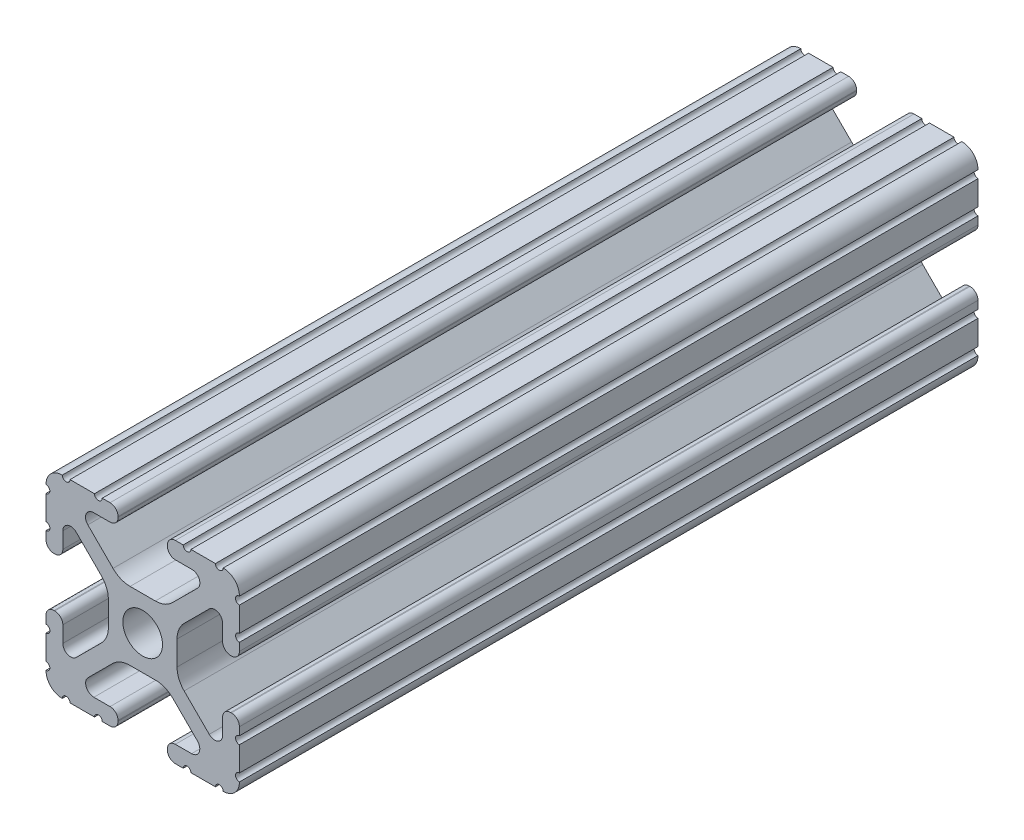
from build123d import *

# Parameters (mm, degrees)
SKETCH1_R      = 2.6035
EXTRUDE1_DEPTH = 97


with BuildPart() as part:
    # Sketch1 → Extrude1 (new body)
    with BuildSketch(Plane.XY):
        with BuildLine():
            Line((-7.207036008, 8.724370562), (-3.898272566, 5.423169045))
            ThreePointArc((-3.898272566, 5.423169045), (-2.869120213, 4.736787962), (-1.655778399, 4.4958))
            Line((-1.655778399, 4.4958), (1.655778399, 4.4958))
            ThreePointArc((1.655778399, 4.4958), (2.869120213, 4.736787962), (3.898272566, 5.423169045))
            Line((3.898272566, 5.423169045), (7.207036008, 8.724370562))
            ThreePointArc((7.207036008, 8.724370562), (7.432222385, 9.85140422), (6.476788598, 10.4902))
            Line((6.476788598, 10.4902), (4.287512407, 10.4902))
            ThreePointArc((4.287512407, 10.4902), (3.54574862, 10.79744862), (3.2385, 11.539212407))
            Line((3.2385, 11.539212407), (3.2385, 11.650987593))
            ThreePointArc((3.2385, 11.650987593), (3.54574862, 12.39275138), (4.287512407, 12.7))
            Line((4.287512407, 12.7), (5.317126718, 12.7))
            ThreePointArc((5.317126718, 12.7), (5.825126718, 12.192), (6.333126718, 12.7))
            Line((6.333126718, 12.7), (9.550443118, 12.7))
            ThreePointArc((9.550443118, 12.7), (10.058366869, 12.192000006), (10.566443095, 12.699847501))
            ThreePointArc((10.566443095, 12.699847501), (12.082537762, 12.08250727), (12.699846982, 10.566399977))
            ThreePointArc((12.699846982, 10.566399977), (12.192000006, 10.058323491), (12.7, 9.5504))
            Line((12.7, 9.5504), (12.7, 6.3330836))
            ThreePointArc((12.7, 6.3330836), (12.192, 5.8250836), (12.7, 5.3170836))
            Line((12.7, 5.3170836), (12.7, 4.287469289))
            ThreePointArc((12.7, 4.287469289), (12.39275138, 3.545705502), (11.650987593, 3.238456882))
            Line((11.650987593, 3.238456882), (11.539212407, 3.238456882))
            ThreePointArc((11.539212407, 3.238456882), (10.79744862, 3.545705502), (10.4902, 4.287469289))
            Line((10.4902, 4.287469289), (10.4902, 6.402089023))
            ThreePointArc((10.4902, 6.402089023), (9.856505071, 7.351067942), (8.737131347, 7.129408934))
            Line((8.737131347, 7.129408934), (5.441005833, 3.840816462))
            ThreePointArc((5.441005833, 3.840816462), (4.750877967, 2.809883091), (4.5085, 1.593185507))
            Line((4.5085, 1.593185507), (4.5085, -1.593185507))
            ThreePointArc((4.5085, -1.593185507), (4.750877967, -2.809883091), (5.441005833, -3.840816462))
            Line((5.441005833, -3.840816462), (8.737131347, -7.129408934))
            ThreePointArc((8.737131347, -7.129408934), (9.856505071, -7.351067942), (10.4902, -6.402089023))
            Line((10.4902, -6.402089023), (10.4902, -4.287469289))
            ThreePointArc((10.4902, -4.287469289), (10.79744862, -3.545705502), (11.539212407, -3.238456882))
            Line((11.539212407, -3.238456882), (11.650987593, -3.238456882))
            ThreePointArc((11.650987593, -3.238456882), (12.39275138, -3.545705502), (12.7, -4.287469289))
            Line((12.7, -4.287469289), (12.7, -5.3170836))
            ThreePointArc((12.7, -5.3170836), (12.192, -5.8250836), (12.7, -6.3330836))
            Line((12.7, -6.3330836), (12.7, -9.5504))
            ThreePointArc((12.7, -9.5504), (12.192000006, -10.058323491), (12.699846982, -10.566399977))
            ThreePointArc((12.699846982, -10.566399977), (12.082537762, -12.08250727), (10.566443095, -12.699847501))
            ThreePointArc((10.566443095, -12.699847501), (10.058366869, -12.192000006), (9.550443118, -12.7))
            Line((9.550443118, -12.7), (6.333126718, -12.7))
            ThreePointArc((6.333126718, -12.7), (5.825126718, -12.192), (5.317126718, -12.7))
            Line((5.317126718, -12.7), (4.287512407, -12.7))
            ThreePointArc((4.287512407, -12.7), (3.54574862, -12.39275138), (3.2385, -11.650987593))
            Line((3.2385, -11.650987593), (3.2385, -11.539212407))
            ThreePointArc((3.2385, -11.539212407), (3.54574862, -10.79744862), (4.287512407, -10.4902))
            Line((4.287512407, -10.4902), (6.416408329, -10.4902))
            ThreePointArc((6.416408329, -10.4902), (7.41473083, -9.822813117), (7.179650497, -8.645192506))
            Line((7.179650497, -8.645192506), (3.952270251, -5.423690499))
            ThreePointArc((3.952270251, -5.423690499), (2.922936451, -4.736929036), (1.709253557, -4.4958))
            Line((1.709253557, -4.4958), (-1.709253557, -4.4958))
            ThreePointArc((-1.709253557, -4.4958), (-2.922936451, -4.736929036), (-3.952270251, -5.423690499))
            Line((-3.952270251, -5.423690499), (-7.179650497, -8.645192506))
            ThreePointArc((-7.179650497, -8.645192506), (-7.41473083, -9.822813117), (-6.416408329, -10.4902))
            Line((-6.416408329, -10.4902), (-4.287512407, -10.4902))
            ThreePointArc((-4.287512407, -10.4902), (-3.54574862, -10.79744862), (-3.2385, -11.539212407))
            Line((-3.2385, -11.539212407), (-3.2385, -11.650987593))
            ThreePointArc((-3.2385, -11.650987593), (-3.54574862, -12.39275138), (-4.287512407, -12.7))
            Line((-4.287512407, -12.7), (-5.317126718, -12.7))
            ThreePointArc((-5.317126718, -12.7), (-5.825126718, -12.192), (-6.333126718, -12.7))
            Line((-6.333126718, -12.7), (-9.550443118, -12.7))
            ThreePointArc((-9.550443118, -12.7), (-10.058366869, -12.192000006), (-10.566443095, -12.699847501))
            ThreePointArc((-10.566443095, -12.699847501), (-12.082537762, -12.08250727), (-12.699846982, -10.566399977))
            ThreePointArc((-12.699846982, -10.566399977), (-12.192000006, -10.058323491), (-12.7, -9.5504))
            Line((-12.7, -9.5504), (-12.7, -6.3330836))
            ThreePointArc((-12.7, -6.3330836), (-12.192, -5.8250836), (-12.7, -5.3170836))
            Line((-12.7, -5.3170836), (-12.7, -4.287469289))
            ThreePointArc((-12.7, -4.287469289), (-12.39275138, -3.545705502), (-11.650987593, -3.238456882))
            Line((-11.650987593, -3.238456882), (-11.539212407, -3.238456882))
            ThreePointArc((-11.539212407, -3.238456882), (-10.79744862, -3.545705502), (-10.4902, -4.287469289))
            Line((-10.4902, -4.287469289), (-10.4902, -6.402089023))
            ThreePointArc((-10.4902, -6.402089023), (-9.856505071, -7.351067942), (-8.737131347, -7.129408934))
            Line((-8.737131347, -7.129408934), (-5.441005833, -3.840816462))
            ThreePointArc((-5.441005833, -3.840816462), (-4.750877967, -2.809883091), (-4.5085, -1.593185507))
            Line((-4.5085, -1.593185507), (-4.5085, 1.593185507))
            ThreePointArc((-4.5085, 1.593185507), (-4.750877967, 2.809883091), (-5.441005833, 3.840816462))
            Line((-5.441005833, 3.840816462), (-8.737131347, 7.129408934))
            ThreePointArc((-8.737131347, 7.129408934), (-9.856505071, 7.351067942), (-10.4902, 6.402089023))
            Line((-10.4902, 6.402089023), (-10.4902, 4.287469289))
            ThreePointArc((-10.4902, 4.287469289), (-10.79744862, 3.545705502), (-11.539212407, 3.238456882))
            Line((-11.539212407, 3.238456882), (-11.650987593, 3.238456882))
            ThreePointArc((-11.650987593, 3.238456882), (-12.39275138, 3.545705502), (-12.7, 4.287469289))
            Line((-12.7, 4.287469289), (-12.7, 5.3170836))
            ThreePointArc((-12.7, 5.3170836), (-12.192, 5.8250836), (-12.7, 6.3330836))
            Line((-12.7, 6.3330836), (-12.7, 9.5504))
            ThreePointArc((-12.7, 9.5504), (-12.192000006, 10.058323491), (-12.699846982, 10.566399977))
            ThreePointArc((-12.699846982, 10.566399977), (-12.082537762, 12.08250727), (-10.566443095, 12.699847501))
            ThreePointArc((-10.566443095, 12.699847501), (-10.058366869, 12.192000006), (-9.550443118, 12.7))
            Line((-9.550443118, 12.7), (-6.333126718, 12.7))
            ThreePointArc((-6.333126718, 12.7), (-5.825126718, 12.192), (-5.317126718, 12.7))
            Line((-5.317126718, 12.7), (-4.287512407, 12.7))
            ThreePointArc((-4.287512407, 12.7), (-3.54574862, 12.39275138), (-3.2385, 11.650987593))
            Line((-3.2385, 11.650987593), (-3.2385, 11.539212407))
            ThreePointArc((-3.2385, 11.539212407), (-3.54574862, 10.79744862), (-4.287512407, 10.4902))
            Line((-4.287512407, 10.4902), (-6.476788598, 10.4902))
            ThreePointArc((-6.476788598, 10.4902), (-7.432222385, 9.85140422), (-7.207036008, 8.724370562))
        make_face()
        Circle(SKETCH1_R, mode=Mode.SUBTRACT)
    extrude(amount=-EXTRUDE1_DEPTH)


solid = part.part
